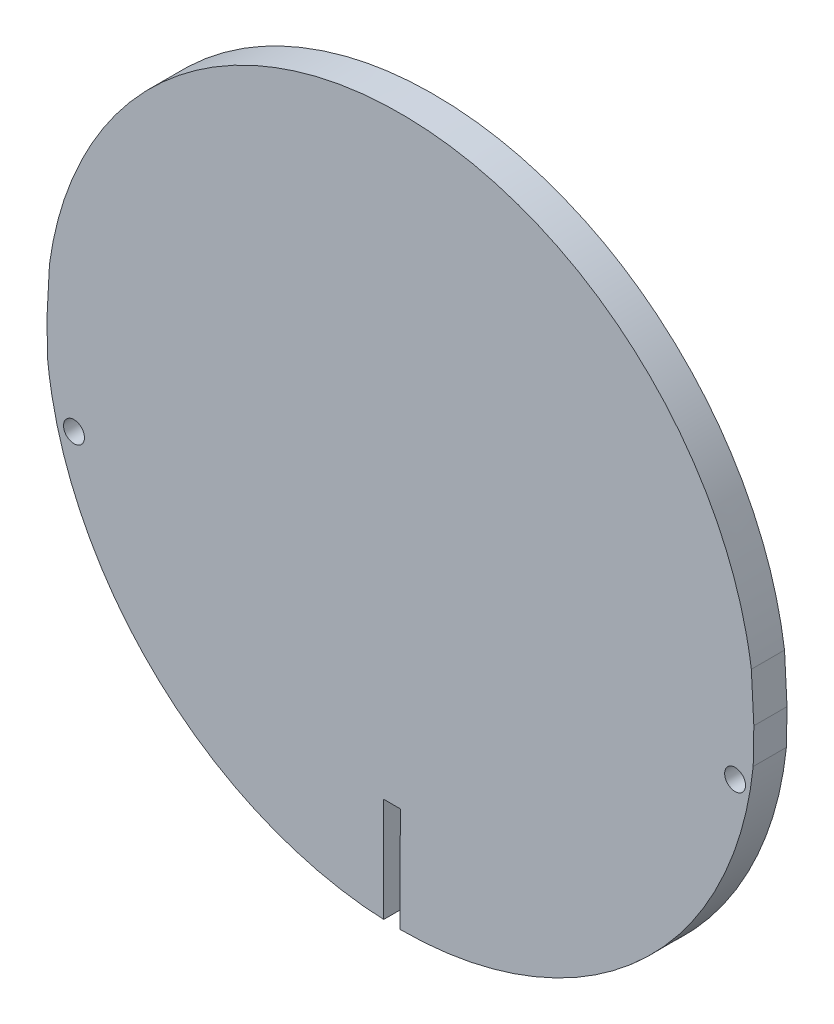
from build123d import *

# Parameters (mm, degrees)
BOSS_EXTRUDE1_DEPTH = 3.175
SKETCH2_R           = 1
CUT_EXTRUDE1_DEPTH  = 3.175
CUT_EXTRUDE2_DEPTH  = 3.175


with BuildPart() as part:
    # Sketch1 → Boss-Extrude1 (new body)
    with BuildSketch(Plane.XY.offset(377.209374622)):
        with BuildLine():
            Line((-33.799525455, -0.017072147), (-33.740147252, -3.418847174))
            add(Edge.make_bspline(
                [(-33.740147252, -3.418847174), (-33.521913435, -5.496739744), (-33.121758608, -7.52360336), (-32.245655467, -10.48651683), (-31.738647045, -11.948631126), (-31.127755378, -13.381606109), (-30.697366268, -14.330435347), (-30.470378572, -14.801900059), (-29.290211733, -17.119612441), (-27.644930506, -19.740333777), (-25.646898465, -22.113857284), (-24.588376817, -23.258919171), (-24.224726915, -23.634521718), (-23.482012785, -24.367327148), (-21.59014774, -26.150424449), (-18.705670827, -28.317861845), (-15.980786711, -29.823605713), (-14.107006772, -30.74768667), (-13.152701084, -31.164175695), (-10.256242476, -32.27934775), (-7.777960893, -32.988270972), (-5.214339656, -33.405899808), (-4.181967985, -33.549320099), (-3.661328308, -33.60925586), (-2.104532681, -33.751997759), (-1.069213869, -33.798542764), (2.029597644, -33.801687472), (4.085962141, -33.622116253), (7.155117004, -33.058726493), (8.178081257, -32.820670852), (10.177000978, -32.256577633), (11.158104767, -31.929888742), (14.04936497, -30.823232748), (15.907936031, -29.917809181), (18.13673294, -28.556406158), (18.576889104, -28.273087614), (19.438710135, -27.689460729), (20.706973253, -26.786573761), (21.903631517, -25.803366446), (23.438553372, -24.424422105), (24.544411843, -23.339363165), (25.578640539, -22.173955923), (26.251776296, -21.378677652), (26.580969723, -20.970778515), (28.17094662, -18.902925334), (29.269671397, -17.152899222), (30.678907287, -14.395868232), (31.108821176, -13.454846631), (31.884053374, -11.526054988), (32.230015293, -10.534907216), (33.119638114, -7.539302803), (33.521651228, -5.499562958), (33.740182048, -3.418847117)],
                knots=[0, 0, 0, 0, 0.0625, 0.0625, 0.09375, 0.109375, 0.109375, 0.125, 0.125, 0.1875, 0.21875, 0.21875, 0.234375, 0.234375, 0.25, 0.3125, 0.34375, 0.34375, 0.375, 0.375, 0.4375, 0.453125, 0.453125, 0.46875, 0.46875, 0.5, 0.5, 0.5625, 0.5625, 0.59375, 0.59375, 0.625, 0.625, 0.6875, 0.6875, 0.703125, 0.703125, 0.71875, 0.75, 0.75, 0.78125, 0.796875, 0.796875, 0.8125, 0.8125, 0.875, 0.875, 0.90625, 0.90625, 0.9375, 0.9375, 1, 1, 1, 1], degree=3))
            Line((33.740182048, -3.418847117), (33.799560251, -0.017072147))
            Line((33.799560251, -0.017072147), (33.560412457, 4.546139609))
            add(Edge.make_bspline(
                [(33.560412457, 4.546139609), (33.282065399, 6.567374379), (32.831372803, 8.534230691), (31.894626922, 11.402256897), (31.361087401, 12.815708643), (30.729491779, 14.19822173), (30.286610148, 15.113013144), (30.053701075, 15.567925007), (28.845742701, 17.805295292), (27.73617385, 19.487837269), (25.852855801, 21.84749908), (25.188593752, 22.606698061), (23.786460552, 24.069913543), (23.045059446, 24.776640829), (20.752328135, 26.778284029), (18.311067746, 28.558159122), (15.640647898, 29.995877244), (14.266739996, 30.656956524), (13.801141084, 30.868163008), (12.864758887, 31.267971853), (12.393699461, 31.456783193), (10.024605965, 32.347483289), (7.115279765, 33.1594713), (4.10232218, 33.57067126), (2.070213322, 33.754033964), (1.053662161, 33.799146951), (-1.978663229, 33.802802386), (-4.487220386, 33.587681269), (-6.97150073, 33.084409187), (-7.963243622, 32.859726611), (-8.459399615, 32.73533069), (-9.933669217, 32.329805435), (-10.897365307, 32.016750487), (-13.734609646, 30.957514861), (-15.554750033, 30.092235814), (-17.734673571, 28.798227251), (-18.165893543, 28.52880028), (-19.018645374, 27.968342063), (-19.439187613, 27.677889019), (-20.673952363, 26.783179445), (-21.465207676, 26.153069384), (-23.74871726, 24.167631397), (-25.151109466, 22.717611147), (-26.742507526, 20.734807748), (-27.053436756, 20.328702835), (-27.654958645, 19.504501759), (-28.525682186, 18.252011757), (-29.304349299, 16.952301265), (-30.745483656, 14.293275375), (-31.551336523, 12.44113352), (-32.506911863, 9.533039369), (-32.781055324, 8.547728647), (-33.237634192, 6.561909519), (-33.420905282, 5.558925362), (-33.560377664, 4.546139552)],
                knots=[0, 0, 0, 0, 0.0625, 0.0625, 0.09375, 0.109375, 0.109375, 0.125, 0.125, 0.1875, 0.1875, 0.21875, 0.21875, 0.25, 0.25, 0.3125, 0.34375, 0.34375, 0.359375, 0.359375, 0.375, 0.375, 0.4375, 0.46875, 0.46875, 0.5, 0.5, 0.5625, 0.578125, 0.578125, 0.59375, 0.59375, 0.625, 0.625, 0.6875, 0.6875, 0.703125, 0.703125, 0.71875, 0.71875, 0.75, 0.75, 0.8125, 0.8125, 0.828125, 0.828125, 0.84375, 0.875, 0.875, 0.9375, 0.9375, 0.96875, 0.96875, 1, 1, 1, 1], degree=3))
            Line((-33.560377664, 4.546139552), (-33.799525455, -0.017072147))
        make_face()
    extrude(amount=-BOSS_EXTRUDE1_DEPTH)

    # Sketch2 → Cut-Extrude1 (cut)
    with BuildSketch(Plane.XY.offset(377.209374622)):
        with Locations((32.009302375, -5.358989516)):
            Circle(SKETCH2_R)
        with Locations((-31.216064399, -8.164436653)):
            Circle(SKETCH2_R)
    extrude(amount=-CUT_EXTRUDE1_DEPTH, mode=Mode.SUBTRACT)

    # Sketch3 → Cut-Extrude2 (cut)
    with BuildSketch(Plane.XY.offset(377.209374622)):
        with BuildLine():
            Line((-0.018642697, -33.799604512), (-0.013127042, -23.799604512))
            Line((-0.013127042, -23.799604512), (-1.600627042, -23.799604512))
            Line((-1.600627042, -23.799604512), (-1.600627042, -33.762903096))
            add(Edge.make_bspline(
                [(-1.600627042, -33.762903096), (-1.078557444, -33.786966452), (-0.557114308, -33.799062449), (-0.030398621, -33.799596965), (-0.024520621, -33.79960146), (-0.018642697, -33.799604483)],
                knots=[0.484242822, 0.484242822, 0.484242822, 0.484242822, 0.5, 0.5, 0.500177833, 0.500177833, 0.500177833, 0.500177833], degree=3))
        make_face()
    extrude(amount=-CUT_EXTRUDE2_DEPTH, mode=Mode.SUBTRACT)


solid = part.part
